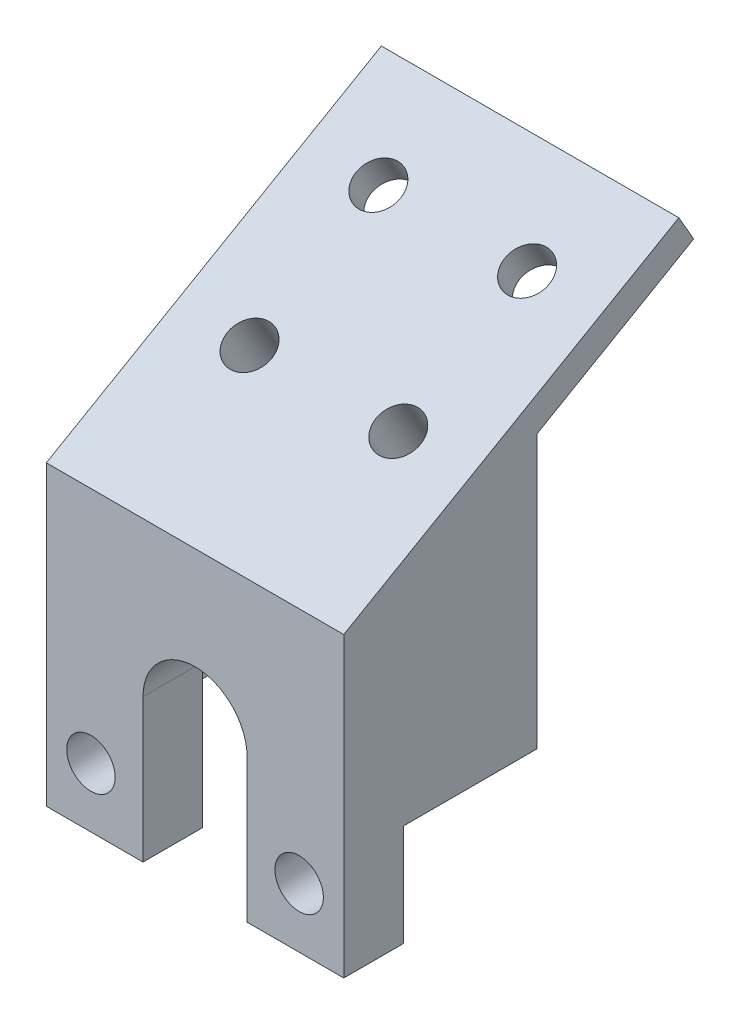
from build123d import *

# Parameters (mm, degrees)
CROQUIS1_R              = 1.628014373
SALIENTE_EXTRUIR1_DEPTH = 4
SALIENTE_EXTRUIR2_DEPTH = 9
CROQUIS10_R             = 1
CORTAR_EXTRUIR3_DEPTH   = 4
SALIENTE_EXTRUIR3_DEPTH = 20
SALIENTE_EXTRUIR4_DEPTH = 20
CROQUIS17_R             = 1.5
CORTAR_EXTRUIR6_DEPTH   = 4
CROQUIS19_W             = 20
CROQUIS19_H             = 4
CORTAR_EXTRUIR7_DEPTH   = 2


with BuildPart() as part:
    # Croquis1 → Saliente-Extruir1 (new body)
    with BuildSketch(Plane.XY):
        with BuildLine():
            Line((-79.034482165, 42.285614206), (-79.034482165, 34.285614206))
            Line((-79.034482165, 34.285614206), (-85.534482165, 34.285614206))
            Line((-85.534482165, 34.285614206), (-85.534482165, 43.91362858))
            ThreePointArc((-85.534482165, 43.91362858), (-89.034482165, 47.41362858), (-92.534482165, 43.91362858))
            Line((-92.534482165, 43.91362858), (-92.534482165, 34.285614206))
            Line((-92.534482165, 34.285614206), (-99.034482165, 34.285614206))
            Line((-99.034482165, 34.285614206), (-99.034482165, 42.285614206))
            Line((-99.034482165, 42.285614206), (-99.034482165, 54.285614206))
            Line((-99.034482165, 54.285614206), (-79.034482165, 54.285614206))
            Line((-79.034482165, 54.285614206), (-79.034482165, 42.285614206))
        make_face()
        with Locations((-96.034482165, 38.285614206)):
            Circle(CROQUIS1_R, mode=Mode.SUBTRACT)
        with Locations((-82.034482165, 38.285614206)):
            Circle(CROQUIS1_R, mode=Mode.SUBTRACT)
    extrude(amount=SALIENTE_EXTRUIR1_DEPTH)

    # Croquis2 → Saliente-Extruir2 (add)
    with BuildSketch(Plane(origin=(0, 0, 0), x_dir=(-1, 0, 0), z_dir=(0, 0, -1))):
        with BuildLine():
            Line((79.034482165, 41.131975098), (83.718242525, 41.131975098))
            ThreePointArc((83.718242525, 41.131975098), (89.034482165, 49.91362858), (94.350721805, 41.131975098))
            Line((94.350721805, 41.131975098), (99.034482165, 41.131975098))
            Line((99.034482165, 41.131975098), (99.034482165, 54.285614206))
            Line((99.034482165, 54.285614206), (79.034482165, 54.285614206))
            Line((79.034482165, 54.285614206), (79.034482165, 41.131975098))
        make_face()
    extrude(amount=SALIENTE_EXTRUIR2_DEPTH)

    # Croquis10 → Cortar-Extruir3 (cut)
    with BuildSketch(Plane(origin=(0, 0, -9), x_dir=(-1, 0, 0), z_dir=(0, 0, -1))):
        with Locations((96.534482165, 51.785614206)):
            Circle(CROQUIS10_R)
        with Locations((81.034482165, 43.131975098)):
            Circle(CROQUIS10_R)
    extrude(amount=-CORTAR_EXTRUIR3_DEPTH, mode=Mode.SUBTRACT)

    # Croquis11 → Saliente-Extruir3 (add)
    with BuildSketch(Plane.ZY.offset(99.034482165)):
        Polygon((-9, 54.285614206), (-9, 61.791167706), (4, 54.285614206), align=None)
    extrude(amount=-SALIENTE_EXTRUIR3_DEPTH)

    # Croquis16 → Saliente-Extruir4 (add)
    with BuildSketch(Plane.ZY.offset(99.034482165)):
        Polygon((-9, 61.791167706), (-21.990381057, 69.291167706), (-22.990381057, 67.559116898), (-9, 59.481766629), align=None)
    extrude(amount=-SALIENTE_EXTRUIR4_DEPTH)

    # Croquis17 → Cortar-Extruir6 (cut)
    with BuildSketch(Plane(origin=(0, 42.446261462, 24.506360481), x_dir=(1, 0, 0), z_dir=(0, 0.8660254037844418, 0.49999999999999484))):
        with Locations(Location((-84.034482165, 33.684258988, 0), (0, 0, 270))):
            Circle(CROQUIS17_R)
        with Locations(Location((-94.034482165, 33.684258988, 0), (0, 0, 270))):
            Circle(CROQUIS17_R)
        with Locations(Location((-94.034482165, 43.684258988, 0), (0, 0, 270))):
            Circle(CROQUIS17_R)
        with Locations(Location((-84.034482165, 43.684258988, 0), (0, 0, 270))):
            Circle(CROQUIS17_R)
    extrude(amount=-CORTAR_EXTRUIR6_DEPTH, mode=Mode.SUBTRACT)

    # Croquis19 → Cortar-Extruir7 (cut)
    with BuildSketch(Plane(origin=(0, 42.446261462, 24.506360481), x_dir=(1, 0, 0), z_dir=(0, 0.8660254037844418, 0.49999999999999484))):
        with Locations((-89.034482165, 51.689812487)):
            Rectangle(CROQUIS19_W, CROQUIS19_H)
    extrude(amount=-CORTAR_EXTRUIR7_DEPTH, mode=Mode.SUBTRACT)


solid = part.part
